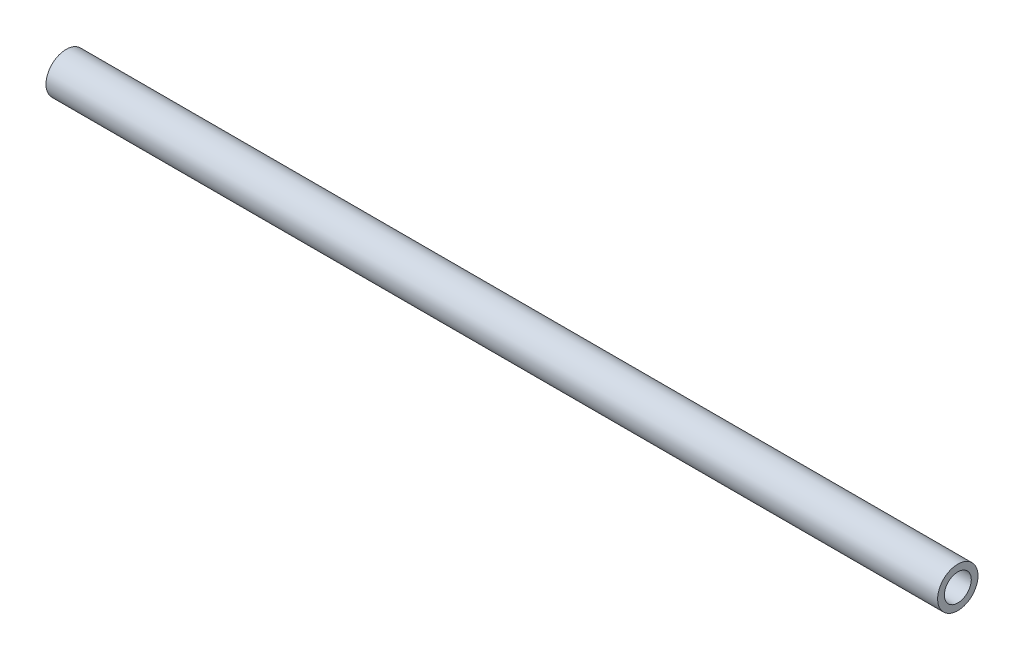
from build123d import *

# Parameters (mm, degrees)
SKETCH1_W      = 5300
SKETCH1_H      = 40
REVOLVE1_ANGLE = 359.999999589


with BuildPart() as part:
    # Sketch1 → Revolve1 (revolve)
    with BuildSketch(Plane.XY):
        with Locations((3550, 100)):
            Rectangle(SKETCH1_W, SKETCH1_H)
    revolve(axis=Axis((0, 0, 0), (1, 0, 0)), revolution_arc=REVOLVE1_ANGLE)


solid = part.part
